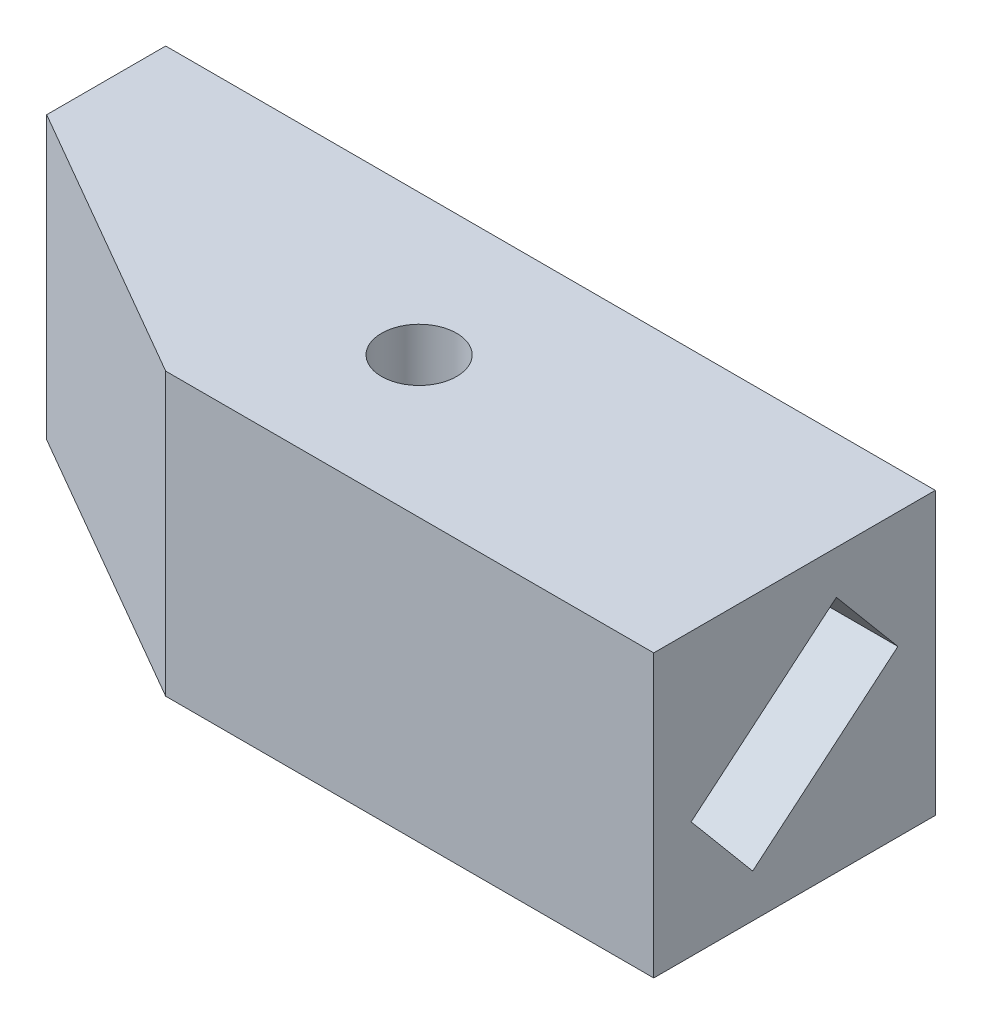
from build123d import *

# Parameters (mm, degrees)
EXTRUDE_1_DEPTH     = 30
SKETCH_2_R          = 4
CUT_EXTRUDE_1_DEPTH = 49.476798574
CUT_EXTRUDE_4_DEPTH = 30
SKETCH1_W           = 30
SKETCH1_H           = 30
BOSS_EXTRUDE1_DEPTH = 27
CHAMFER1_SIZE       = 30
CHAMFER1_SIZE2      = 17.320508076


with BuildPart() as part:
    # Эскиз1 → Бобышка-Вытянуть1 (new body)
    with BuildSketch(Plane(origin=(0, 0, 0), x_dir=(1, 0, 0), z_dir=(0, 1, 0))):
        Polygon((-20, 15), (-35, 15), (-35, -15), (-20, -15), (20, -15), (20, 15), align=None)
    extrude(amount=EXTRUDE_1_DEPTH)

    # Эскиз2 → Вырез-Вытянуть1 (cut, through all)
    with BuildSketch(Plane(origin=(0, 30, 0), x_dir=(1, 0, 0), z_dir=(0, 1, 0))):
        with Locations(Location((-20, 0, 0), (0, 0, 270))):
            Circle(SKETCH_2_R)
    extrude(amount=-CUT_EXTRUDE_1_DEPTH, mode=Mode.SUBTRACT)

    # Эскиз5 → Вырез-Вытянуть4 (cut)
    with BuildSketch(Plane(origin=(20, 0, 0), x_dir=(0, 0, -1), z_dir=(1, 0, 0))):
        Polygon((11.015265685, 17.585328198), (4.458832066, 25.398981518), (-11.015265685, 12.414671802), (-4.458832066, 4.601018482), align=None)
    extrude(amount=-CUT_EXTRUDE_4_DEPTH, mode=Mode.SUBTRACT)

    # Sketch1 → Boss-Extrude1 (add)
    with BuildSketch(Plane.ZY.offset(35)):
        with Locations((0, 15)):
            Rectangle(SKETCH1_W, SKETCH1_H)
    extrude(amount=BOSS_EXTRUDE1_DEPTH)

    # Chamfer1
    chamfer1_edges = [part.edges().sort_by_distance(p)[0] for p in [
        (-62, 15, 15),
    ]]
    chamfer1_side = [part.faces().sort_by_distance(p)[0] for p in [
        (-21, 15, 15),
    ]]
    chamfer(chamfer1_edges, length=CHAMFER1_SIZE, length2=CHAMFER1_SIZE2, reference=chamfer1_side[0])


solid = part.part
